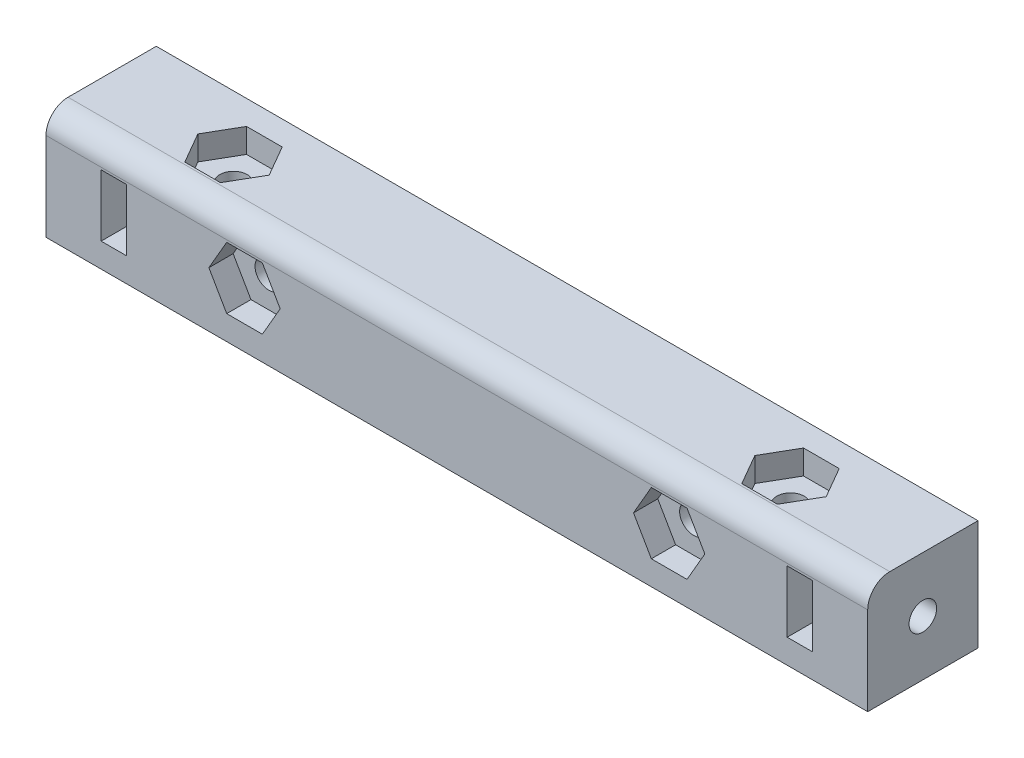
from build123d import *

# Parameters (mm, degrees)
SKETCH1_W           = 74.5
SKETCH1_H           = 10
BOSS_EXTRUDE1_DEPTH = 10
SKETCH2_R           = 1.25
CUT_EXTRUDE1_DEPTH  = 10
SKETCH3_R           = 1.25
CUT_EXTRUDE2_DEPTH  = 10
SKETCH4_R           = 1.25
CUT_EXTRUDE3_DEPTH  = 5
CUT_EXTRUDE4_START  = -5
SKETCH5_R           = 1.25
CUT_EXTRUDE4_DEPTH  = 5
CUT_EXTRUDE5_DEPTH  = 2.2
CUT_EXTRUDE6_DEPTH  = 2.2
CUT_EXTRUDE7_DEPTH  = 2.2
CUT_EXTRUDE8_DEPTH  = 2.2
SKETCH11_W          = 2.3
SKETCH11_H          = 5.6
CUT_EXTRUDE9_DEPTH  = 7.3
FILLET1_R           = 2


with BuildPart() as part:
    # Sketch1 → Boss-Extrude1 (new body)
    with BuildSketch(Plane(origin=(0, 0, 0), x_dir=(1, 0, 0), z_dir=(0, 1, 0))):
        with Locations((37.25, 5)):
            Rectangle(SKETCH1_W, SKETCH1_H)
    extrude(amount=BOSS_EXTRUDE1_DEPTH)

    # Sketch2 → Cut-Extrude1 (cut)
    with BuildSketch(Plane(origin=(0, 10, 0), x_dir=(1, 0, 0), z_dir=(0, 1, 0))):
        with Locations(Location((12, 5, 0), (0, 0, 270))):
            Circle(SKETCH2_R)
        with Locations(Location((62.5, 5, 0), (0, 0, 270))):
            Circle(SKETCH2_R)
    extrude(amount=-CUT_EXTRUDE1_DEPTH, mode=Mode.SUBTRACT)

    # Sketch3 → Cut-Extrude2 (cut)
    with BuildSketch(Plane(origin=(0, 0, -10), x_dir=(-1, 0, 0), z_dir=(0, 0, -1))):
        with Locations((-56.5, 5)):
            Circle(SKETCH3_R)
        with Locations((-18, 5)):
            Circle(SKETCH3_R)
    extrude(amount=-CUT_EXTRUDE2_DEPTH, mode=Mode.SUBTRACT)

    # Sketch4 → Cut-Extrude3 (cut)
    with BuildSketch(Plane(origin=(74.5, 0, 0), x_dir=(0, 0, -1), z_dir=(1, 0, 0))):
        with Locations((5, 5)):
            Circle(SKETCH4_R)
    extrude(amount=-CUT_EXTRUDE3_DEPTH, mode=Mode.SUBTRACT)

    # Sketch5 → Cut-Extrude4 (cut)
    with BuildSketch(Plane.ZY.offset(CUT_EXTRUDE4_START)):
        with Locations(Location((-5, 5, 0), (0, 0, 180))):
            Circle(SKETCH5_R)
    extrude(amount=CUT_EXTRUDE4_DEPTH, mode=Mode.SUBTRACT)

    # Sketch6 → Cut-Extrude5 (cut)
    with BuildSketch(Plane(origin=(0, 10, 0), x_dir=(1, 0, 0), z_dir=(0, 1, 0))):
        Polygon((13.616580754, 2.2), (15.233161507, 5), (13.616580754, 7.8), (10.383419246, 7.8), (8.766838493, 5), (10.383419246, 2.2), align=None)
    extrude(amount=-CUT_EXTRUDE5_DEPTH, mode=Mode.SUBTRACT)

    # Sketch7 → Cut-Extrude6 (cut)
    with BuildSketch(Plane(origin=(0, 10, 0), x_dir=(1, 0, 0), z_dir=(0, 1, 0))):
        Polygon((60.883419246, 7.8), (59.266838493, 5), (60.883419246, 2.2), (64.116580754, 2.2), (65.733161507, 5), (64.116580754, 7.8), align=None)
    extrude(amount=-CUT_EXTRUDE6_DEPTH, mode=Mode.SUBTRACT)

    # Sketch8 → Cut-Extrude7 (cut)
    with BuildSketch(Plane.XY):
        Polygon((16.383419246, 2.2), (19.616580754, 2.2), (21.233161507, 5), (19.616580754, 7.8), (16.383419246, 7.8), (14.766838493, 5), align=None)
    extrude(amount=-CUT_EXTRUDE7_DEPTH, mode=Mode.SUBTRACT)

    # Sketch9 → Cut-Extrude8 (cut)
    with BuildSketch(Plane.XY):
        Polygon((58.116580754, 7.8), (54.883419246, 7.8), (53.266838493, 5), (54.883419246, 2.2), (58.116580754, 2.2), (59.733161507, 5), align=None)
    extrude(amount=-CUT_EXTRUDE8_DEPTH, mode=Mode.SUBTRACT)

    # Sketch11 → Cut-Extrude9 (cut)
    with BuildSketch(Plane.XY):
        with Locations((6.15, 5)):
            Rectangle(SKETCH11_W, SKETCH11_H)
        with Locations((68.35, 5)):
            Rectangle(SKETCH11_W, SKETCH11_H)
    extrude(amount=-CUT_EXTRUDE9_DEPTH, mode=Mode.SUBTRACT)

    # Fillet1
    fillet1_edges = [part.edges().sort_by_distance(p)[0] for p in [
        (37.25, 10, 0),
    ]]
    fillet(fillet1_edges, radius=FILLET1_R)


solid = part.part
